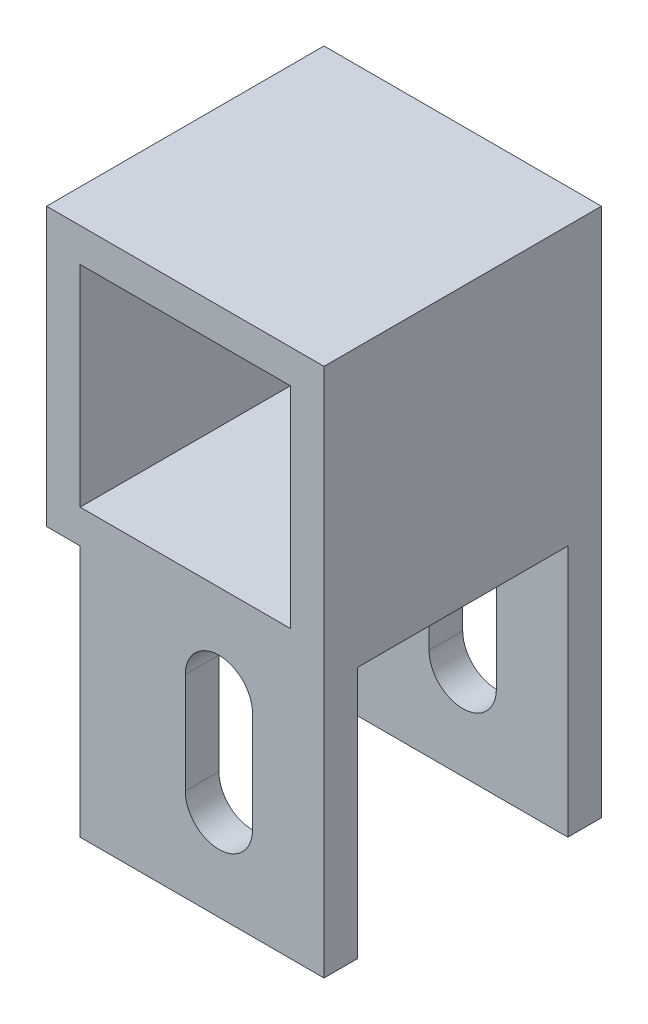
from build123d import *

# Parameters (mm, degrees)
SKETCH20_W                = 33
SKETCH20_H                = 33
SKETCH20_W_2              = 25
SKETCH20_H_2              = 25
BOSS_EXTRUDE12_DEPTH      = 33
BOSS_EXTRUDE13_DEPTH      = 30
BOSS_EXTRUDE13_DEPTH_BACK = 4
SKETCH22_W                = 33
SKETCH22_H                = 4
SKETCH23_W                = 4
SKETCH23_H                = 4
CUT_EXTRUDE10_DEPTH       = 30
CUT_EXTRUDE15_DEPTH       = 33


with BuildPart() as part:
    # Sketch20 → Boss-Extrude12 (new body)
    with BuildSketch(Plane.XY):
        Rectangle(SKETCH20_W, SKETCH20_H)
        Rectangle(SKETCH20_W_2, SKETCH20_H_2, mode=Mode.SUBTRACT)
    extrude(amount=BOSS_EXTRUDE12_DEPTH)

    # Sketch22 → Boss-Extrude13 (add, two sides: drawn at the far end of the back side and taken through both)
    with BuildSketch(Plane.XZ.offset(16.5).offset(-BOSS_EXTRUDE13_DEPTH_BACK)):
        with Locations((0, 31)):
            Rectangle(SKETCH22_W, SKETCH22_H)
        with Locations((0, 2)):
            Rectangle(SKETCH22_W, SKETCH22_H)
    extrude(amount=BOSS_EXTRUDE13_DEPTH + BOSS_EXTRUDE13_DEPTH_BACK)

    # Sketch23 → Cut-Extrude10 (cut)
    with BuildSketch(Plane.XZ.offset(46.5)):
        with Locations((-14.5, 31)):
            Rectangle(SKETCH23_W, SKETCH23_H)
        with Locations((-14.5, 2)):
            Rectangle(SKETCH23_W, SKETCH23_H)
    extrude(amount=-CUT_EXTRUDE10_DEPTH, mode=Mode.SUBTRACT)

    # Sketch36 → Cut-Extrude15 (cut)
    with BuildSketch(Plane(origin=(0, 0, 0), x_dir=(-1, 0, 0), z_dir=(0, 0, -1))):
        with BuildLine():
            Line((-8, -23.5), (-8, -35.5))
            ThreePointArc((-8, -35.5), (-4, -39.5), (0, -35.5))
            Line((0, -35.5), (0, -23.5))
            ThreePointArc((0, -23.5), (-4, -19.5), (-8, -23.5))
        make_face()
    extrude(amount=-CUT_EXTRUDE15_DEPTH, mode=Mode.SUBTRACT)


solid = part.part
